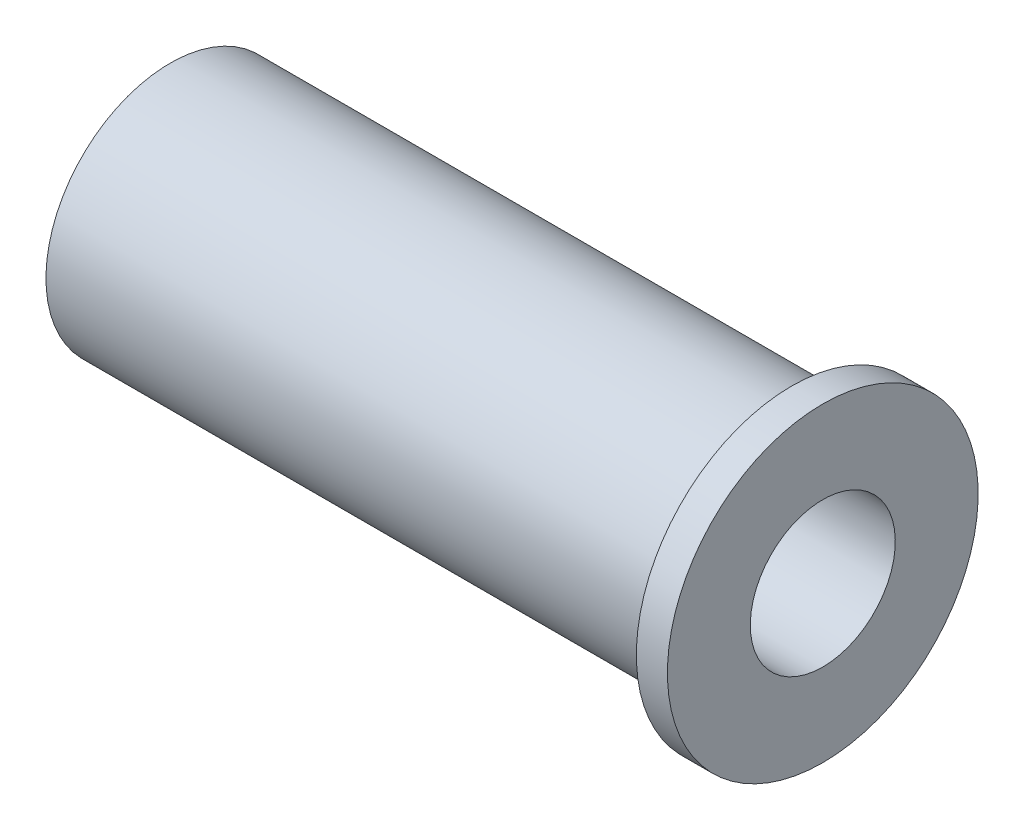
from build123d import *


with BuildPart() as part:
    # Эскиз1 → Повернуть1 (revolve)
    with BuildSketch(Plane.XY, mode=Mode.PRIVATE) as revolve_1_sk:
        Polygon((0, 7), (0, 12), (60, 12), (60, 15), (63, 15), (63, 7), align=None)
    revolve(revolve_1_sk.sketch.rotate(Axis((0, 0, 0), (1, 0, 0)), 180), axis=Axis((0, 0, 0), (1, 0, 0)))


solid = part.part
